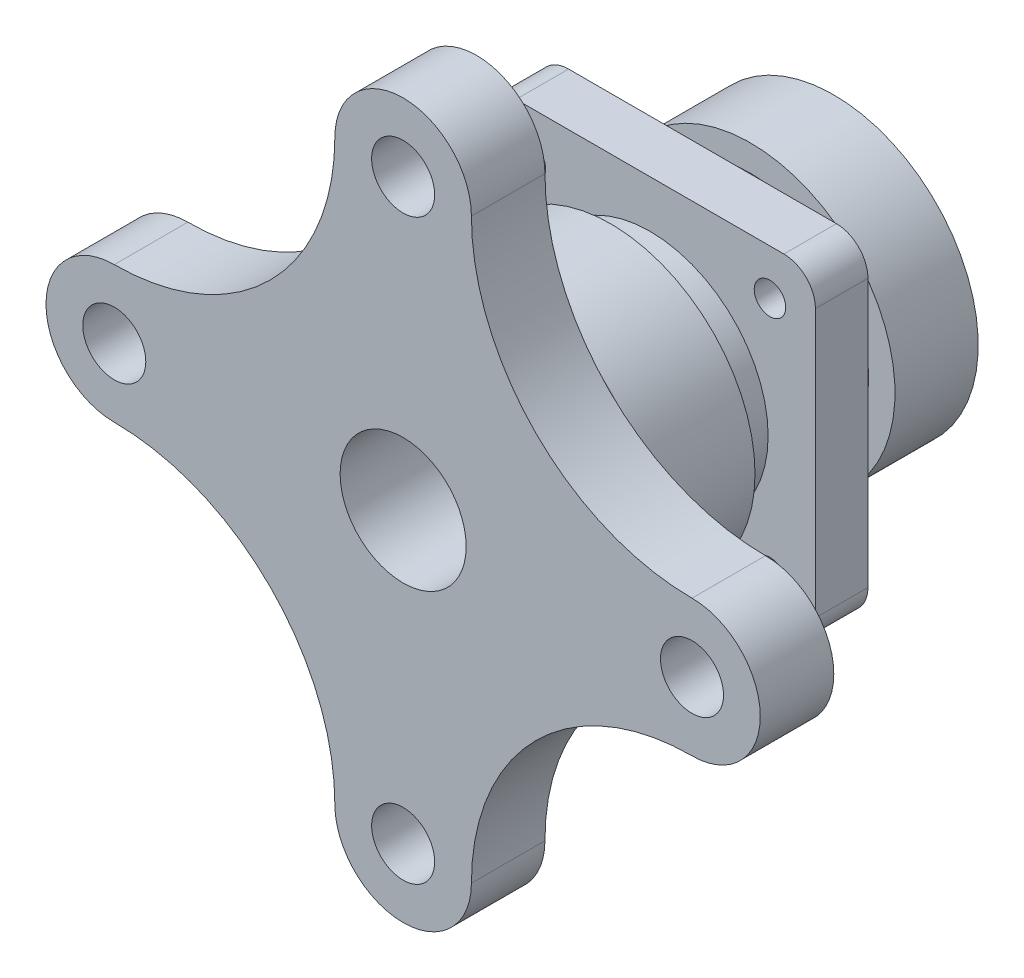
from build123d import *
from build123d.topology import SkipClean

# Parameters (mm, degrees)
SKETCH1_R                = 27.5
SKETCH1_R_2              = 20
BOSS_EXTRUDE1_DEPTH      = 88
SKETCH2_R                = 3
SKETCH2_R_2              = 27.5
BOSS_EXTRUDE2_DEPTH      = 10
SKETCH3_R                = 6
SKETCH3_R_2              = 12
BOSS_EXTRUDE3_DEPTH      = 14
FILLET3_R                = 6
BOSS_EXTRUDE4_DEPTH      = 7.5
BOSS_EXTRUDE4_DEPTH_BACK = 43
SKETCH6_R                = 20
SKETCH6_R_2              = 12
SKETCH7_R                = 27.5
CUT_EXTRUDE1_DEPTH       = 20
SKETCH8_R                = 22.5
CUT_EXTRUDE2_DEPTH       = 17.5
CUT_EXTRUDE5_DEPTH       = 1.9
CUT_EXTRUDE5_DEPTH_BACK  = 7.25
SKETCH11_R               = 27.5
SKETCH11_R_2             = 22.5
SKETCH12_R               = 27.5
SKETCH12_R_2             = 22.5
BOSS_EXTRUDE5_DEPTH      = 15.85
SKETCH13_R               = 22.5
SKETCH13_R_2             = 12
BOSS_EXTRUDE6_DEPTH      = 5.65
SKETCH15_R               = 27.5
SKETCH15_R_2             = 22.5
CUT_EXTRUDE7_DEPTH       = 7.5


with BuildPart() as part:
    # Sketch1 → Boss-Extrude1 (new body)
    with BuildSketch(Plane.XY):
        Circle(SKETCH1_R)
        Circle(SKETCH1_R_2, mode=Mode.SUBTRACT)
    extrude(amount=BOSS_EXTRUDE1_DEPTH)

    # Sketch2 → Boss-Extrude2 (add)
    with BuildSketch(Plane(origin=(0, 0, 45), x_dir=(-1, 0, 0), z_dir=(0, 0, -1))):
        with BuildLine():
            Line((-25.5, -31.5), (25.5, -31.5))
            ThreePointArc((25.5, -31.5), (29.742640687, -29.742640687), (31.5, -25.5))
            Line((31.5, -25.5), (31.5, 25.5))
            ThreePointArc((31.5, 25.5), (29.742640687, 29.742640687), (25.5, 31.5))
            Line((25.5, 31.5), (-25.5, 31.5))
            ThreePointArc((-25.5, 31.5), (-29.742640687, 29.742640687), (-31.5, 25.5))
            Line((-31.5, 25.5), (-31.5, -25.5))
            ThreePointArc((-31.5, -25.5), (-29.742640687, -29.742640687), (-25.5, -31.5))
        make_face()
        with Locations((22.8466201, 22.8466201)):
            Circle(SKETCH2_R, mode=Mode.SUBTRACT)
        with Locations(Location((-22.8466201, -22.8466201, 0), (0, 0, 180))):
            Circle(SKETCH2_R, mode=Mode.SUBTRACT)
        with Locations(Location((22.8466201, -22.8466201, 0), (0, 0, 180))):
            Circle(SKETCH2_R, mode=Mode.SUBTRACT)
        with Locations((-22.8466201, 22.8466201)):
            Circle(SKETCH2_R, mode=Mode.SUBTRACT)
        Circle(SKETCH2_R_2, mode=Mode.SUBTRACT)
    extrude(amount=-BOSS_EXTRUDE2_DEPTH)

    # Sketch3 → Boss-Extrude3 (add)
    with BuildSketch(Plane.XY.offset(88)):
        with BuildLine():
            ThreePointArc((55, 13), (25.30151519, 25.30151519), (13, 55))
            ThreePointArc((13, 55), (0, 68), (-13, 55))
            ThreePointArc((-13, 55), (-25.30151519, 25.30151519), (-55, 13))
            ThreePointArc((-55, 13), (-68, 0), (-55, -13))
            ThreePointArc((-55, -13), (-25.30151519, -25.30151519), (-13, -55))
            ThreePointArc((-13, -55), (0, -68), (13, -55))
            ThreePointArc((13, -55), (25.30151519, -25.30151519), (55, -13))
            ThreePointArc((55, -13), (68, 0), (55, 13))
        make_face()
        with Locations((0, -55)):
            Circle(SKETCH3_R, mode=Mode.SUBTRACT)
        with Locations((-55, 0)):
            Circle(SKETCH3_R, mode=Mode.SUBTRACT)
        Circle(SKETCH3_R_2, mode=Mode.SUBTRACT)
        with Locations((55, 0)):
            Circle(SKETCH3_R, mode=Mode.SUBTRACT)
        with Locations((0, 55)):
            Circle(SKETCH3_R, mode=Mode.SUBTRACT)
    extrude(amount=BOSS_EXTRUDE3_DEPTH)

    # Fillet3
    fillet3_edges = [part.edges().sort_by_distance(p)[0] for p in [
        (-27.5, 0, 88),
    ]]
    fillet(fillet3_edges, radius=FILLET3_R)

    # Sketch6 → Boss-Extrude4 (add, two sides: drawn at the far end of the back side and taken through both)
    with SkipClean():  # the faces are left unmerged after this step: merging them gives an invalid solid
        with BuildSketch(Plane(origin=(0, 0, 45), x_dir=(-1, 0, 0), z_dir=(0, 0, -1)).offset(-BOSS_EXTRUDE4_DEPTH_BACK)):
            Circle(SKETCH6_R)
            Circle(SKETCH6_R_2, mode=Mode.SUBTRACT)
        extrude(amount=BOSS_EXTRUDE4_DEPTH + BOSS_EXTRUDE4_DEPTH_BACK)

    # Sketch7 → Cut-Extrude1 (cut)
    with SkipClean():  # the faces are left unmerged after this step: merging them gives an invalid solid
        with BuildSketch(Plane(origin=(0, 0, 0), x_dir=(-1, 0, 0), z_dir=(0, 0, -1))):
            Circle(SKETCH7_R)
        extrude(amount=-CUT_EXTRUDE1_DEPTH, mode=Mode.SUBTRACT)

    # Sketch8 → Cut-Extrude2 (cut)
    with SkipClean():  # the faces are left unmerged after this step: merging them gives an invalid solid
        with BuildSketch(Plane(origin=(0, 0, 20), x_dir=(-1, 0, 0), z_dir=(0, 0, -1))):
            Circle(SKETCH8_R)
        extrude(amount=-CUT_EXTRUDE2_DEPTH, mode=Mode.SUBTRACT)

    # Sketch11 → Cut-Extrude5 (cut, two sides: drawn at the far end of the back side and taken through both)
    with SkipClean():  # the faces are left unmerged after this step: merging them gives an invalid solid
        with BuildSketch(Plane(origin=(0, 0, 37.75), x_dir=(-1, 0, 0), z_dir=(0, 0, -1)).offset(-CUT_EXTRUDE5_DEPTH_BACK)):
            Circle(SKETCH11_R)
            with Locations(Location((0, 0, 0), (0, 0, 180))):
                Circle(SKETCH11_R_2, mode=Mode.SUBTRACT)
        extrude(amount=CUT_EXTRUDE5_DEPTH + CUT_EXTRUDE5_DEPTH_BACK, mode=Mode.SUBTRACT)


with BuildPart() as cut_extrude5_piece_1:
    # of the separate pieces the step leaves, piece 1, a body of its own (cut_extrude5_pieces)
    add(part.part.solids().sort_by_distance((33.5, 0, 88))[0])

    # Sketch13 → Boss-Extrude6 (add)
    with SkipClean():  # the faces are left unmerged after this step: merging them gives an invalid solid
        with BuildSketch(Plane(origin=(0, 0, 37.5), x_dir=(-1, 0, 0), z_dir=(0, 0, -1))):
            with Locations(Location((0, 0, 0), (0, 0, 180))):
                Circle(SKETCH13_R)
            Circle(SKETCH13_R_2, mode=Mode.SUBTRACT)
        extrude(amount=BOSS_EXTRUDE6_DEPTH)

    # Sketch15 → Cut-Extrude7 (cut)
    with SkipClean():  # the faces are left unmerged after this step: merging them gives an invalid solid
        with BuildSketch(Plane.XY.offset(55)):
            Circle(SKETCH15_R)
            Circle(SKETCH15_R_2, mode=Mode.SUBTRACT)
        extrude(amount=CUT_EXTRUDE7_DEPTH, mode=Mode.SUBTRACT)


with BuildPart() as cut_extrude5_piece_2:
    # of the separate pieces the step leaves, piece 2, a body of its own (cut_extrude5_pieces)
    add(part.part.solids().sort_by_distance((27.5, 0, 20))[0])

    # Sketch12 → Boss-Extrude5 (add)
    with BuildSketch(Plane(origin=(0, 0, 20), x_dir=(-1, 0, 0), z_dir=(0, 0, -1))):
        Circle(SKETCH12_R)
        with Locations(Location((0, 0, 0), (0, 0, 180))):
            Circle(SKETCH12_R_2, mode=Mode.SUBTRACT)
    extrude(amount=-BOSS_EXTRUDE5_DEPTH)


solid = Compound([cut_extrude5_piece_1.part, cut_extrude5_piece_2.part])
